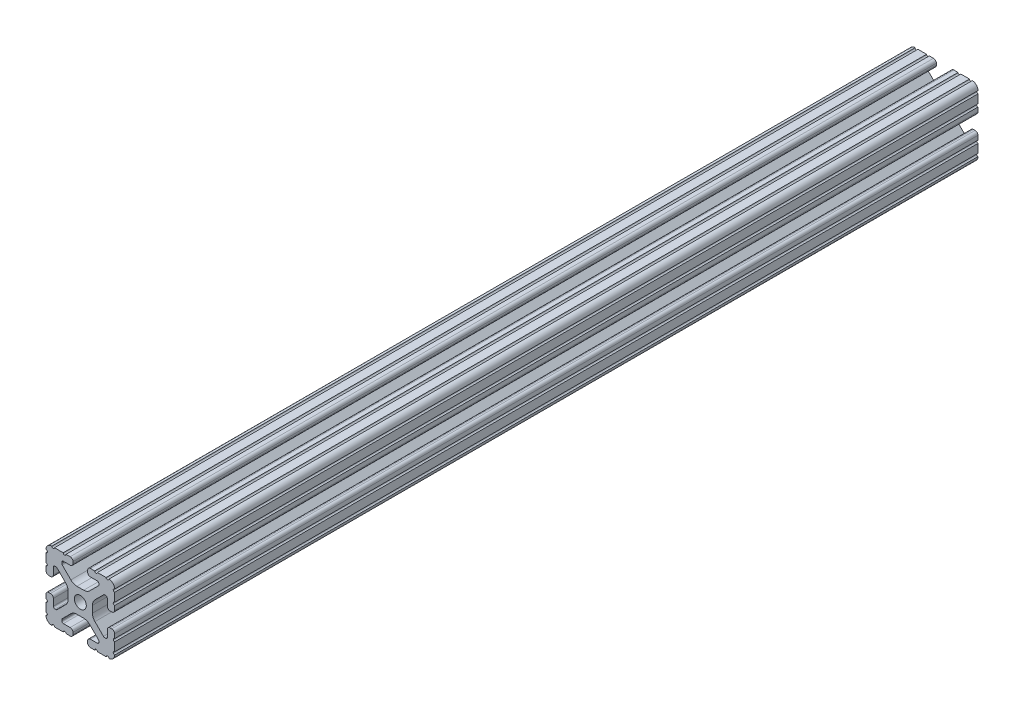
from build123d import *

# Parameters (mm, degrees)
SKETCH1_R           = 3.3274
BOSS_EXTRUDE1_DEPTH = 479.425


with BuildPart() as part:
    # Sketch1 → Boss-Extrude1 (new body)
    with BuildSketch(Plane.XY):
        with BuildLine():
            Line((-14.097, 10.287), (-13.528918, 10.287))
            ThreePointArc((-13.528918, 10.287), (-13.188712428, 10.219328904), (-12.900300071, 10.026617928))
            Line((-12.900300071, 10.026617928), (-8.129198975, 5.255516832))
            ThreePointArc((-8.129198975, 5.255516832), (-7.09957176, 3.71457081), (-6.738014764, 1.896901043))
            Line((-6.738014764, 1.896901043), (-6.738014764, -1.896901043))
            ThreePointArc((-6.738014764, -1.896901043), (-7.09957176, -3.71457081), (-8.129198975, -5.255516832))
            Line((-8.129198975, -5.255516832), (-12.900300071, -10.026617928))
            ThreePointArc((-12.900300071, -10.026617928), (-13.188712428, -10.219328904), (-13.528918, -10.287))
            Line((-13.528918, -10.287), (-14.097, -10.287))
            ThreePointArc((-14.097, -10.287), (-14.725617928, -10.026617928), (-14.986, -9.398))
            Line((-14.986, -9.398), (-14.986, -5.6388))
            ThreePointArc((-14.986, -5.6388), (-15.447248241, -4.525248241), (-16.5608, -4.064))
            Line((-16.5608, -4.064), (-17.4752, -4.064))
            ThreePointArc((-17.4752, -4.064), (-18.588751759, -4.525248241), (-19.05, -5.6388))
            Line((-19.05, -5.6388), (-19.05, -7.9756))
            ThreePointArc((-19.05, -7.9756), (-18.288, -8.7376), (-19.05, -9.4996))
            Line((-19.05, -9.4996), (-19.05, -14.3256))
            ThreePointArc((-19.05, -14.3256), (-18.288, -15.0876), (-19.05, -15.8496))
            Line((-19.05, -15.8496), (-19.05, -15.875))
            ThreePointArc((-19.05, -15.875), (-18.12006403, -18.12006403), (-15.875, -19.05))
            Line((-15.875, -19.05), (-15.8496, -19.05))
            ThreePointArc((-15.8496, -19.05), (-15.0876, -18.288), (-14.3256, -19.05))
            Line((-14.3256, -19.05), (-9.4996, -19.05))
            ThreePointArc((-9.4996, -19.05), (-8.7376, -18.288), (-7.9756, -19.05))
            Line((-7.9756, -19.05), (-5.6388, -19.05))
            ThreePointArc((-5.6388, -19.05), (-4.525248241, -18.588751759), (-4.064, -17.4752))
            Line((-4.064, -17.4752), (-4.064, -16.5608))
            ThreePointArc((-4.064, -16.5608), (-4.525248241, -15.447248241), (-5.6388, -14.986))
            Line((-5.6388, -14.986), (-9.398, -14.986))
            ThreePointArc((-9.398, -14.986), (-10.026617928, -14.725617928), (-10.287, -14.097))
            Line((-10.287, -14.097), (-10.287, -13.528918))
            ThreePointArc((-10.287, -13.528918), (-10.219328904, -13.188712428), (-10.026617928, -12.900300071))
            Line((-10.026617928, -12.900300071), (-5.255516832, -8.129198975))
            ThreePointArc((-5.255516832, -8.129198975), (-3.71457081, -7.09957176), (-1.896901043, -6.738014764))
            Line((-1.896901043, -6.738014764), (1.896901043, -6.738014764))
            ThreePointArc((1.896901043, -6.738014764), (3.71457081, -7.09957176), (5.255516832, -8.129198975))
            Line((5.255516832, -8.129198975), (10.026617928, -12.900300071))
            ThreePointArc((10.026617928, -12.900300071), (10.219328904, -13.188712428), (10.287, -13.528918))
            Line((10.287, -13.528918), (10.287, -14.097))
            ThreePointArc((10.287, -14.097), (10.026617928, -14.725617928), (9.398, -14.986))
            Line((9.398, -14.986), (5.6388, -14.986))
            ThreePointArc((5.6388, -14.986), (4.525248241, -15.447248241), (4.064, -16.5608))
            Line((4.064, -16.5608), (4.064, -17.4752))
            ThreePointArc((4.064, -17.4752), (4.525248241, -18.588751759), (5.6388, -19.05))
            Line((5.6388, -19.05), (7.9756, -19.05))
            ThreePointArc((7.9756, -19.05), (8.7376, -18.288), (9.4996, -19.05))
            Line((9.4996, -19.05), (14.3256, -19.05))
            ThreePointArc((14.3256, -19.05), (15.0876, -18.288), (15.8496, -19.05))
            Line((15.8496, -19.05), (15.875, -19.05))
            ThreePointArc((15.875, -19.05), (18.12006403, -18.12006403), (19.05, -15.875))
            Line((19.05, -15.875), (19.05, -15.8496))
            ThreePointArc((19.05, -15.8496), (18.288, -15.0876), (19.05, -14.3256))
            Line((19.05, -14.3256), (19.05, -9.4996))
            ThreePointArc((19.05, -9.4996), (18.288, -8.7376), (19.05, -7.9756))
            Line((19.05, -7.9756), (19.05, -5.6388))
            ThreePointArc((19.05, -5.6388), (18.588751759, -4.525248241), (17.4752, -4.064))
            Line((17.4752, -4.064), (16.5608, -4.064))
            ThreePointArc((16.5608, -4.064), (15.447248241, -4.525248241), (14.986, -5.6388))
            Line((14.986, -5.6388), (14.986, -9.398))
            ThreePointArc((14.986, -9.398), (14.725617928, -10.026617928), (14.097, -10.287))
            Line((14.097, -10.287), (13.528918, -10.287))
            ThreePointArc((13.528918, -10.287), (13.188712428, -10.219328904), (12.900300071, -10.026617928))
            Line((12.900300071, -10.026617928), (8.129198975, -5.255516832))
            ThreePointArc((8.129198975, -5.255516832), (7.09957176, -3.71457081), (6.738014764, -1.896901043))
            Line((6.738014764, -1.896901043), (6.738014764, 1.896901043))
            ThreePointArc((6.738014764, 1.896901043), (7.09957176, 3.71457081), (8.129198975, 5.255516832))
            Line((8.129198975, 5.255516832), (12.900300071, 10.026617928))
            ThreePointArc((12.900300071, 10.026617928), (13.188712428, 10.219328904), (13.528918, 10.287))
            Line((13.528918, 10.287), (14.097, 10.287))
            ThreePointArc((14.097, 10.287), (14.725617928, 10.026617928), (14.986, 9.398))
            Line((14.986, 9.398), (14.986, 5.6388))
            ThreePointArc((14.986, 5.6388), (15.447248241, 4.525248241), (16.5608, 4.064))
            Line((16.5608, 4.064), (17.4752, 4.064))
            ThreePointArc((17.4752, 4.064), (18.588751759, 4.525248241), (19.05, 5.6388))
            Line((19.05, 5.6388), (19.05, 7.9756))
            ThreePointArc((19.05, 7.9756), (18.288, 8.7376), (19.05, 9.4996))
            Line((19.05, 9.4996), (19.05, 14.3256))
            ThreePointArc((19.05, 14.3256), (18.288, 15.0876), (19.05, 15.8496))
            Line((19.05, 15.8496), (19.05, 15.875))
            ThreePointArc((19.05, 15.875), (18.12006403, 18.12006403), (15.875, 19.05))
            Line((15.875, 19.05), (15.8496, 19.05))
            ThreePointArc((15.8496, 19.05), (15.0876, 18.288), (14.3256, 19.05))
            Line((14.3256, 19.05), (9.4996, 19.05))
            ThreePointArc((9.4996, 19.05), (8.7376, 18.288), (7.9756, 19.05))
            Line((7.9756, 19.05), (5.6388, 19.05))
            ThreePointArc((5.6388, 19.05), (4.525248241, 18.588751759), (4.064, 17.4752))
            Line((4.064, 17.4752), (4.064, 16.5608))
            ThreePointArc((4.064, 16.5608), (4.525248241, 15.447248241), (5.6388, 14.986))
            Line((5.6388, 14.986), (9.398, 14.986))
            ThreePointArc((9.398, 14.986), (10.026617928, 14.725617928), (10.287, 14.097))
            Line((10.287, 14.097), (10.287, 13.528918))
            ThreePointArc((10.287, 13.528918), (10.219328904, 13.188712428), (10.026617928, 12.900300071))
            Line((10.026617928, 12.900300071), (5.255516832, 8.129198975))
            ThreePointArc((5.255516832, 8.129198975), (3.71457081, 7.09957176), (1.896901043, 6.738014764))
            Line((1.896901043, 6.738014764), (-1.896901043, 6.738014764))
            ThreePointArc((-1.896901043, 6.738014764), (-3.71457081, 7.09957176), (-5.255516832, 8.129198975))
            Line((-5.255516832, 8.129198975), (-10.026617928, 12.900300071))
            ThreePointArc((-10.026617928, 12.900300071), (-10.219328904, 13.188712428), (-10.287, 13.528918))
            Line((-10.287, 13.528918), (-10.287, 14.097))
            ThreePointArc((-10.287, 14.097), (-10.026617928, 14.725617928), (-9.398, 14.986))
            Line((-9.398, 14.986), (-5.6388, 14.986))
            ThreePointArc((-5.6388, 14.986), (-4.525248241, 15.447248241), (-4.064, 16.5608))
            Line((-4.064, 16.5608), (-4.064, 17.4752))
            ThreePointArc((-4.064, 17.4752), (-4.525248241, 18.588751759), (-5.6388, 19.05))
            Line((-5.6388, 19.05), (-7.9756, 19.05))
            ThreePointArc((-7.9756, 19.05), (-8.7376, 18.288), (-9.4996, 19.05))
            Line((-9.4996, 19.05), (-14.3256, 19.05))
            ThreePointArc((-14.3256, 19.05), (-15.0876, 18.288), (-15.8496, 19.05))
            Line((-15.8496, 19.05), (-15.875, 19.05))
            ThreePointArc((-15.875, 19.05), (-18.12006403, 18.12006403), (-19.05, 15.875))
            Line((-19.05, 15.875), (-19.05, 15.8496))
            ThreePointArc((-19.05, 15.8496), (-18.288, 15.0876), (-19.05, 14.3256))
            Line((-19.05, 14.3256), (-19.05, 9.4996))
            ThreePointArc((-19.05, 9.4996), (-18.288, 8.7376), (-19.05, 7.9756))
            Line((-19.05, 7.9756), (-19.05, 5.6388))
            ThreePointArc((-19.05, 5.6388), (-18.588751759, 4.525248241), (-17.4752, 4.064))
            Line((-17.4752, 4.064), (-16.5608, 4.064))
            ThreePointArc((-16.5608, 4.064), (-15.447248241, 4.525248241), (-14.986, 5.6388))
            Line((-14.986, 5.6388), (-14.986, 9.398))
            ThreePointArc((-14.986, 9.398), (-14.725617928, 10.026617928), (-14.097, 10.287))
        make_face()
        Circle(SKETCH1_R, mode=Mode.SUBTRACT)
    extrude(amount=BOSS_EXTRUDE1_DEPTH)


solid = part.part
